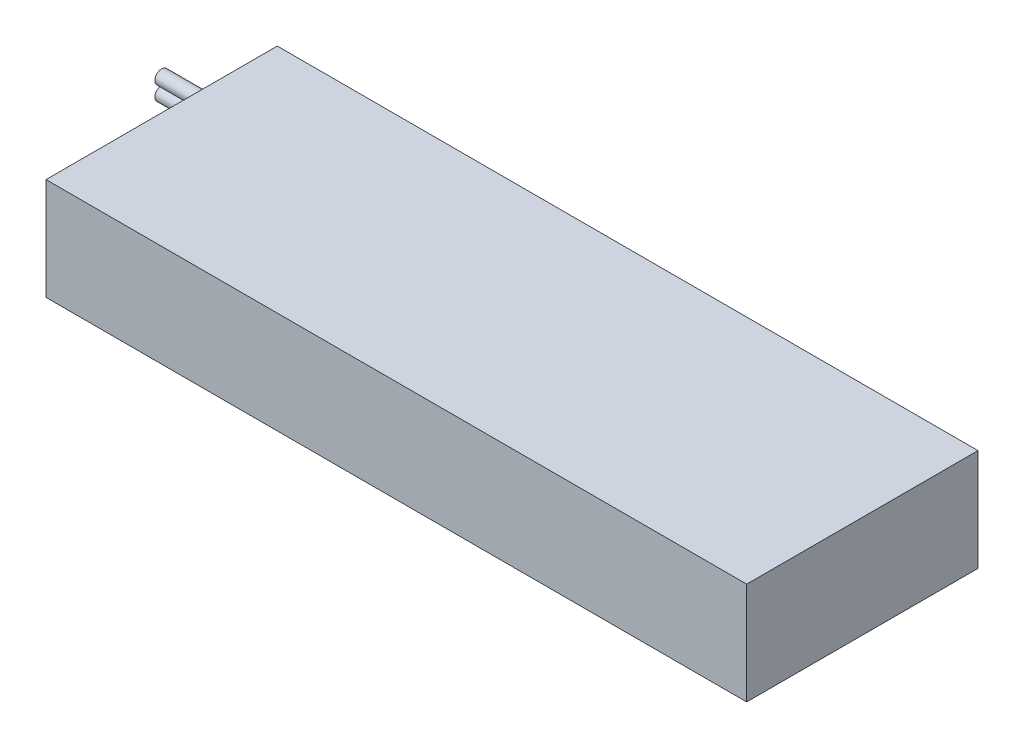
from build123d import *

# Parameters (mm, degrees)
SKETCH1_W           = 103
SKETCH1_H           = 15
BOSS_EXTRUDE1_DEPTH = 34
SKETCH2_R           = 1
BOSS_EXTRUDE2_DEPTH = 15


with BuildPart() as part:
    # Sketch1 → Boss-Extrude1 (new body)
    with BuildSketch(Plane.XY):
        with Locations((51.5, 7.5)):
            Rectangle(SKETCH1_W, SKETCH1_H)
    extrude(amount=BOSS_EXTRUDE1_DEPTH)

    # Sketch2 → Boss-Extrude2 (add)
    with BuildSketch(Plane.ZY):
        with Locations(Location((2, 2.5, 0), (0, 0, 180))):
            Circle(SKETCH2_R)
        with Locations(Location((2, 4.6, 0), (0, 0, 180))):
            Circle(SKETCH2_R)
    extrude(amount=BOSS_EXTRUDE2_DEPTH)


solid = part.part
